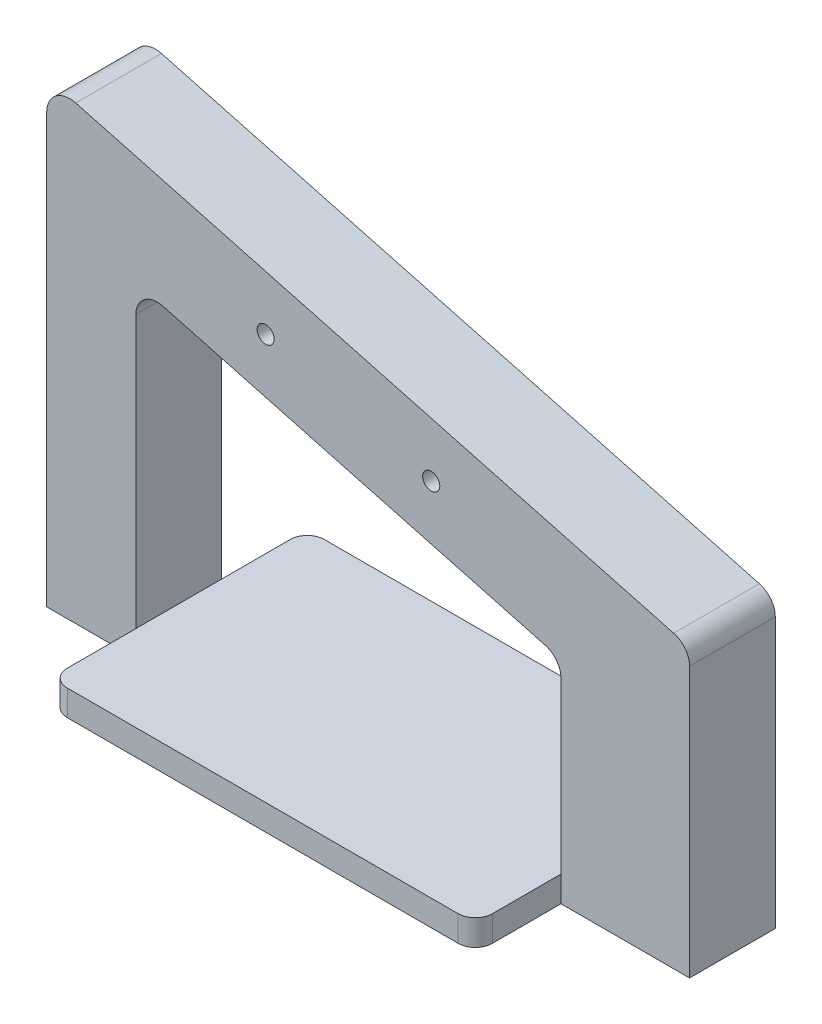
from build123d import *

# Parameters (mm, degrees)
BOSS_EXTRUDE1_DEPTH = 25.4
SKETCH2_W           = 125.987512686
SKETCH2_H           = 7.62
BOSS_EXTRUDE2_DEPTH = 25.4
FILLET1_R           = 5.08
SKETCH3_W           = 125.987512686
SKETCH3_H           = 7.62
BOSS_EXTRUDE3_DEPTH = 25.4
FILLET2_R           = 5.08
SKETCH4_R           = 2.54
CUT_EXTRUDE1_DEPTH  = 170.8092282


with BuildPart() as part:
    # Sketch1 → Boss-Extrude1 (new body)
    with BuildSketch(Plane.XY):
        with BuildLine():
            Line((-101.6, -7.62), (-101.6, 119.38))
            ThreePointArc((-101.6, 119.38), (-98.923175612, 124.808062894), (-92.987256343, 125.988790648))
            Line((-92.987256343, 125.988790648), (84.193500936, 78.513349821))
            ThreePointArc((84.193500936, 78.513349821), (87.587793711, 76.245355898), (88.9, 72.379720824))
            Line((88.9, 72.379720824), (88.9, -7.62))
            Line((88.9, -7.62), (0, -7.62))
            Line((0, -7.62), (-101.6, -7.62))
        make_face()
        with BuildLine():
            Line((0, 0), (50.8, 0))
            Line((50.8, 0), (50.8, 50.269221346))
            ThreePointArc((50.8, 50.269221346), (49.487793711, 54.13485642), (46.093500936, 56.402850343))
            Line((46.093500936, 56.402850343), (-67.194011749, 86.758147879))
            ThreePointArc((-67.194011749, 86.758147879), (-72.70314776, 85.662312593), (-75.187512686, 80.624518882))
            Line((-75.187512686, 80.624518882), (-75.187512686, 0))
            Line((-75.187512686, 0), (0, 0))
        make_face(mode=Mode.SUBTRACT)
    extrude(amount=BOSS_EXTRUDE1_DEPTH)

    # Sketch2 → Boss-Extrude2 (add)
    with BuildSketch(Plane.XY.offset(25.4)):
        with Locations((-12.193756343, -3.81)):
            Rectangle(SKETCH2_W, SKETCH2_H)
    extrude(amount=BOSS_EXTRUDE2_DEPTH)

    # Fillet1
    fillet1_edges = [part.edges().sort_by_distance(p)[0] for p in [
        (-75.187512686, -3.81, 50.8),
        (50.8, -3.81, 50.8),
    ]]
    fillet(fillet1_edges, radius=FILLET1_R)

    # Sketch3 → Boss-Extrude3 (add)
    with BuildSketch(Plane(origin=(0, 0, 0), x_dir=(-1, 0, 0), z_dir=(0, 0, -1))):
        with Locations((12.193756343, -3.81)):
            Rectangle(SKETCH3_W, SKETCH3_H)
    extrude(amount=BOSS_EXTRUDE3_DEPTH)

    # Fillet2
    fillet2_edges = [part.edges().sort_by_distance(p)[0] for p in [
        (-75.187512686, -3.81, -25.4),
        (50.8, -3.81, -25.4),
    ]]
    fillet(fillet2_edges, radius=FILLET2_R)

    # Sketch4 → Cut-Extrude1 (cut, through all)
    with BuildSketch(Plane.XY.offset(25.4)):
        with Locations((-36.728272331, 94.75455946)):
            Circle(SKETCH4_R)
        with Locations((12.340759645, 81.606551969)):
            Circle(SKETCH4_R)
    extrude(amount=-CUT_EXTRUDE1_DEPTH, mode=Mode.SUBTRACT)


solid = part.part
